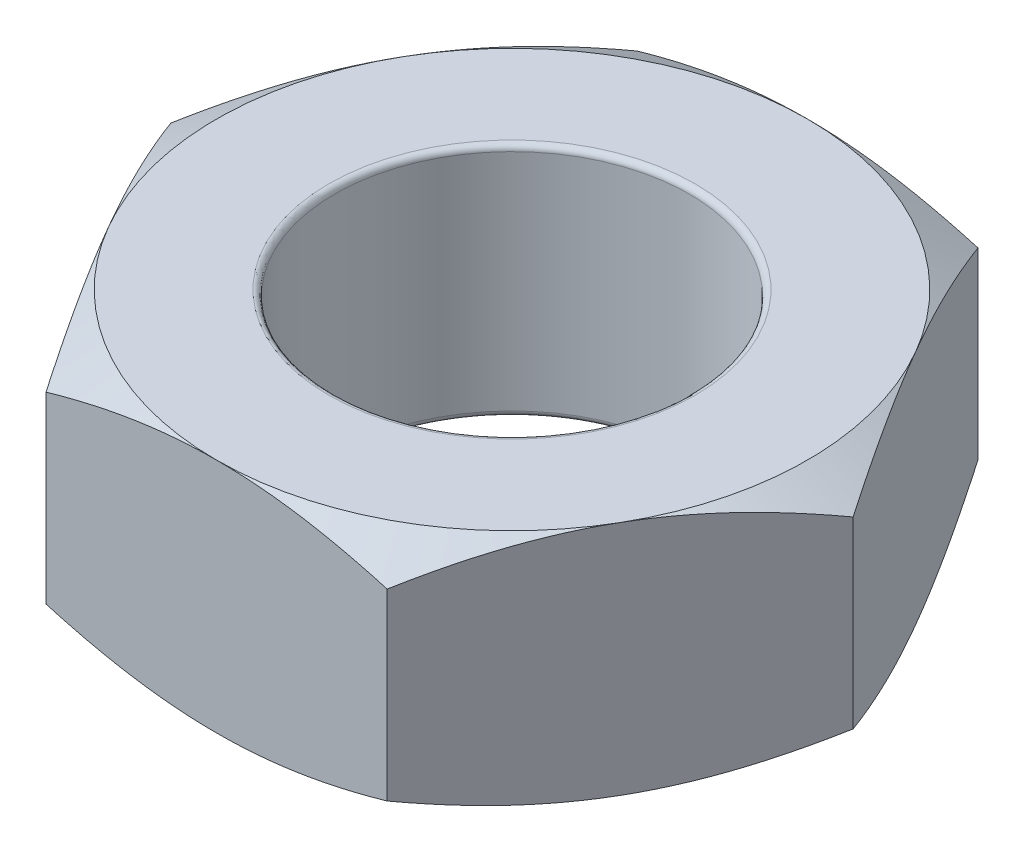
from build123d import *

# Parameters (mm, degrees)
SKETCH1_R           = 0.75
BOSS_EXTRUDE3_DEPTH = 1
SKETCH3_OUTSIDE_W   = 9.14
SKETCH3_OUTSIDE_H   = 8.754
SKETCH3_OUTSIDE_R   = 1.25
CUT_EXTRUDE1_DEPTH  = 1
CUT_EXTRUDE1_DRAFT  = -60
SKETCH4_OUTSIDE_W   = 9.14
SKETCH4_OUTSIDE_H   = 8.754
SKETCH4_OUTSIDE_R   = 1.25
CUT_EXTRUDE2_DEPTH  = 1
CUT_EXTRUDE2_DRAFT  = -60
FILLET1_R           = 0.025


with BuildPart() as part:
    # Sketch1 → Boss-Extrude3 (new body)
    with BuildSketch(Plane(origin=(0, 0, 0), x_dir=(1, 0, 0), z_dir=(0, 1, 0))):
        Polygon((-1.443375673, 0), (-0.721687836, -1.25), (0.721687836, -1.25), (1.443375673, 0), (0.721687836, 1.25), (-0.721687836, 1.25), align=None)
        with Locations(Location((0, 0, 0), (0, 0, 270))):
            Circle(SKETCH1_R, mode=Mode.SUBTRACT)
    extrude(amount=BOSS_EXTRUDE3_DEPTH)


with BuildPart() as cut_extrude1_tool:
    # Sketch3 outside → Cut-Extrude1 (with draft: the straight prism first)
    with BuildSketch(Plane(origin=(0, 1, 0), x_dir=(1, 0, 0), z_dir=(0, 1, 0))):
        Rectangle(SKETCH3_OUTSIDE_W, SKETCH3_OUTSIDE_H)
        Circle(SKETCH3_OUTSIDE_R, mode=Mode.SUBTRACT)
    extrude(amount=-CUT_EXTRUDE1_DEPTH)
    # Cut-Extrude1: the draft: its side faces are tilted about the plane it starts from
    cut_extrude1_sides = [cut_extrude1_tool.faces().sort_by_distance(p)[0] for p in [
        (0, 0.5, 4.377),
        (4.57, 0.5, 0),
        (0, 0.5, -4.377),
        (-4.57, 0.5, 0),
        (-1.25, 0.5, 0),
    ]]
    draft(cut_extrude1_sides, Plane(origin=(0, 1, 0), x_dir=(1, 0, 0), z_dir=(0, 1, 0)), CUT_EXTRUDE1_DRAFT)


with BuildPart() as part_1:
    add(part.part)

    # Cut-Extrude1: cut by cut_extrude1_tool
    add(cut_extrude1_tool.part, mode=Mode.SUBTRACT)


with BuildPart() as cut_extrude2_tool:
    # Sketch4 outside → Cut-Extrude2 (with draft: the straight prism first)
    with BuildSketch(Plane.XZ):
        Rectangle(SKETCH4_OUTSIDE_W, SKETCH4_OUTSIDE_H)
        Circle(SKETCH4_OUTSIDE_R, mode=Mode.SUBTRACT)
    extrude(amount=-CUT_EXTRUDE2_DEPTH)
    # Cut-Extrude2: the draft: its side faces are tilted about the plane it starts from
    cut_extrude2_sides = [cut_extrude2_tool.faces().sort_by_distance(p)[0] for p in [
        (0, 0.5, -4.377),
        (4.57, 0.5, 0),
        (0, 0.5, 4.377),
        (-4.57, 0.5, 0),
        (-1.25, 0.5, 0),
    ]]
    draft(cut_extrude2_sides, Plane.XZ, CUT_EXTRUDE2_DRAFT)


with BuildPart() as part_2:
    add(part_1.part)

    # Cut-Extrude2: cut by cut_extrude2_tool
    add(cut_extrude2_tool.part, mode=Mode.SUBTRACT)

    # Fillet1
    fillet1_edges = [part_2.edges().sort_by_distance(p)[0] for p in [
        (0, 0, -0.75),
        (0, 1, -0.75),
    ]]
    fillet(fillet1_edges, radius=FILLET1_R)


solid = part_2.part
